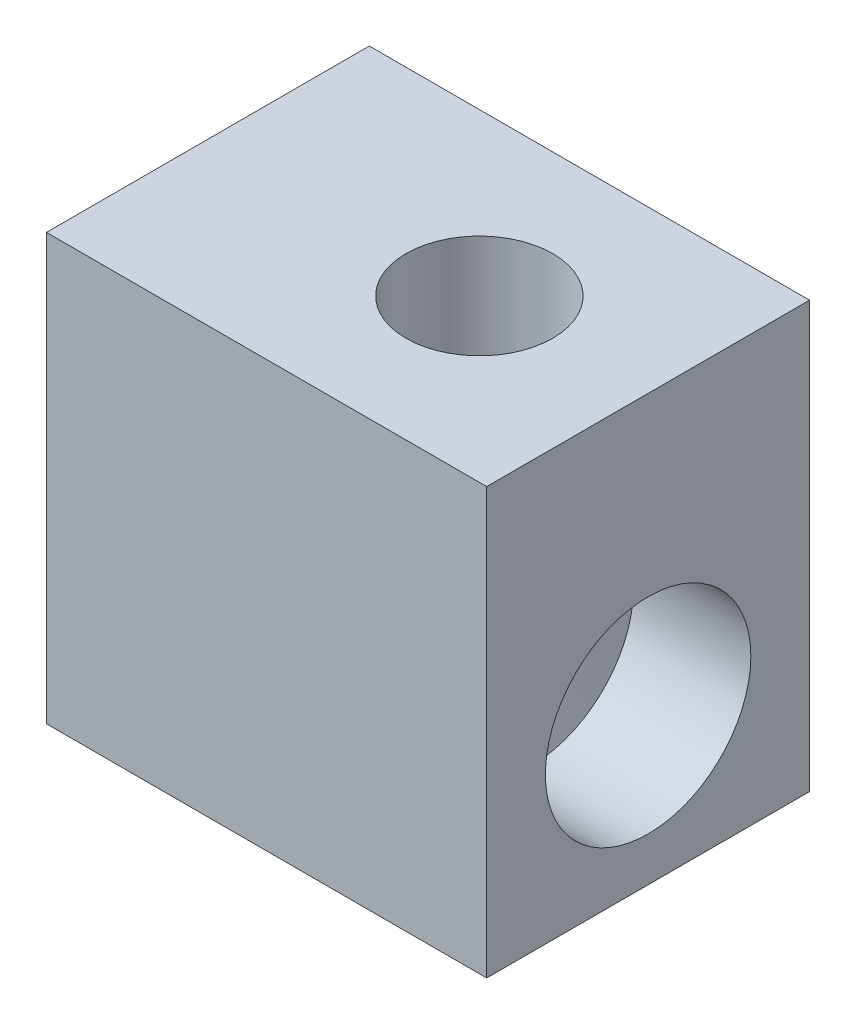
from build123d import *

# Parameters (mm, degrees)
ESQUISSE1_W                  = 30
ESQUISSE1_H                  = 29
BOSS_EXTRU_1_DEPTH           = 22
ESQUISSE2_R                  = 7
ENL_V_MAT_EXTRU_1_DEPTH      = 8
ENL_V_START                  = -8
ESQUISSE3_R                  = 7
ENL_V_MAT_EXTRU_2_DEPTH      = 8
ESQUISSE8_R                  = 5
ENL_V_MAT_EXTRU_3_DEPTH      = 11
ENL_V_MAT_EXTRU_4_REACH      = 43.328
ENL_V_MAT_EXTRU_4_END_RADIUS = 2
ESQUISSE9_R                  = 1.5
ESQUISSE10_R                 = 1
ECHELLE1_SCALE               = 0.578571429


with BuildPart() as part:
    # Esquisse1 → Boss.-Extru.1 (new body)
    with BuildSketch(Plane.XY):
        with Locations((15, 14.5)):
            Rectangle(ESQUISSE1_W, ESQUISSE1_H)
    extrude(amount=BOSS_EXTRU_1_DEPTH)

    # Esquisse2 → Enlèv. mat.-Extru.1 (cut)
    with BuildSketch(Plane.ZY):
        with Locations((11, 10)):
            Circle(ESQUISSE2_R)
    extrude(amount=-ENL_V_MAT_EXTRU_1_DEPTH, mode=Mode.SUBTRACT)

    # Esquisse3 → Enlèv. mat.-Extru.2 (cut)
    with BuildSketch(Plane(origin=(30, 0, 0), x_dir=(0, 0, -1), z_dir=(1, 0, 0)).offset(ENL_V_START)):
        with Locations(Location((-11, 10, 0), (0, 0, 180))):
            Circle(ESQUISSE3_R)
    extrude(amount=ENL_V_MAT_EXTRU_2_DEPTH, mode=Mode.SUBTRACT)

    # Esquisse4 → Enlèvement de matière-Révolution3 (revolve, cut)
    with BuildSketch(Plane(origin=(0, 10, 0), x_dir=(1, 0, 0), z_dir=(0, 1, 0)), mode=Mode.PRIVATE) as enl_vement_de_mati_re_r_volution3_sk:
        Polygon((8, -4), (8, -11), (9, -11), (13, -11), (12, -9), (9, -9), align=None)
        Polygon((21, -11), (22, -11), (22, -4), (21, -9), (17, -9), (16, -11), align=None)
    revolve(enl_vement_de_mati_re_r_volution3_sk.sketch.rotate(Axis((0, 10, 11), (1, 0, 0)), 180), axis=Axis((0, 10, 11), (1, 0, 0)), mode=Mode.SUBTRACT)

    # Esquisse8 → Enlèv. mat.-Extru.3 (cut)
    with BuildSketch(Plane(origin=(0, 29, 0), x_dir=(1, 0, 0), z_dir=(0, 1, 0))):
        with Locations(Location((18.5, -11, 0), (0, 0, 270))):
            Circle(ESQUISSE8_R)
    extrude(amount=-ENL_V_MAT_EXTRU_3_DEPTH, mode=Mode.SUBTRACT)

    # Enlèv. mat.-Extru.4: up to this cylinder (the profile starts outside it)
    enl_v_mat_extru_4_end = Plane(origin=(18.5, 10, 11), z_dir=(-1, 0, 0)) * Cylinder(ENL_V_MAT_EXTRU_4_END_RADIUS, 91.656, mode=Mode.PRIVATE)
    # Esquisse9 → Enlèv. mat.-Extru.4 (cut, up to the surface)
    with BuildSketch(Plane(origin=(0, 18, 0), x_dir=(1, 0, 0), z_dir=(0, 1, 0)), mode=Mode.PRIVATE) as enl_v_mat_extru_4_sk1:
        with Locations(Location((18.5, -11, 0), (0, 0, 270))):
            Circle(ESQUISSE9_R)
    enl_v_mat_extru_4_tool1 = extrude(enl_v_mat_extru_4_sk1.sketch, amount=-ENL_V_MAT_EXTRU_4_REACH, mode=Mode.PRIVATE) - enl_v_mat_extru_4_end
    add(enl_v_mat_extru_4_tool1.solids().sort_by_distance((18.5, 18, 11))[0], mode=Mode.SUBTRACT)

    # Enlèvement de matière-Balayage1: sweep along a path in Esquisse11
    with BuildLine(Plane.XY.offset(11)) as enl_vement_de_mati_re_balayage1_path:
        Line((11, 10), (11, 18))
        ThreePointArc((11, 18), (11.439339828, 19.060660172), (12.5, 19.5))
        Line((12.5, 19.5), (13.5, 19.5))
        Line((13.5, 19.5), (13.72845952, 19.5))
    # Esquisse10 → Enlèvement de matière-Balayage1 (sweep, cut)
    with BuildSketch(Plane(origin=(0, 10, 0), x_dir=(1, 0, 0), z_dir=(0, 1, 0))):
        with Locations((11, -11)):
            Circle(ESQUISSE10_R)
    sweep(path=enl_vement_de_mati_re_balayage1_path.line, mode=Mode.SUBTRACT)


with BuildPart() as part_1:
    # Echelle1: scaled about (14.800414232, 14.777105317, 10.999999711)
    add(part.part.scale(ECHELLE1_SCALE).moved(Location((6.237317426, 6.227494384, 4.635714164))))


solid = part_1.part
